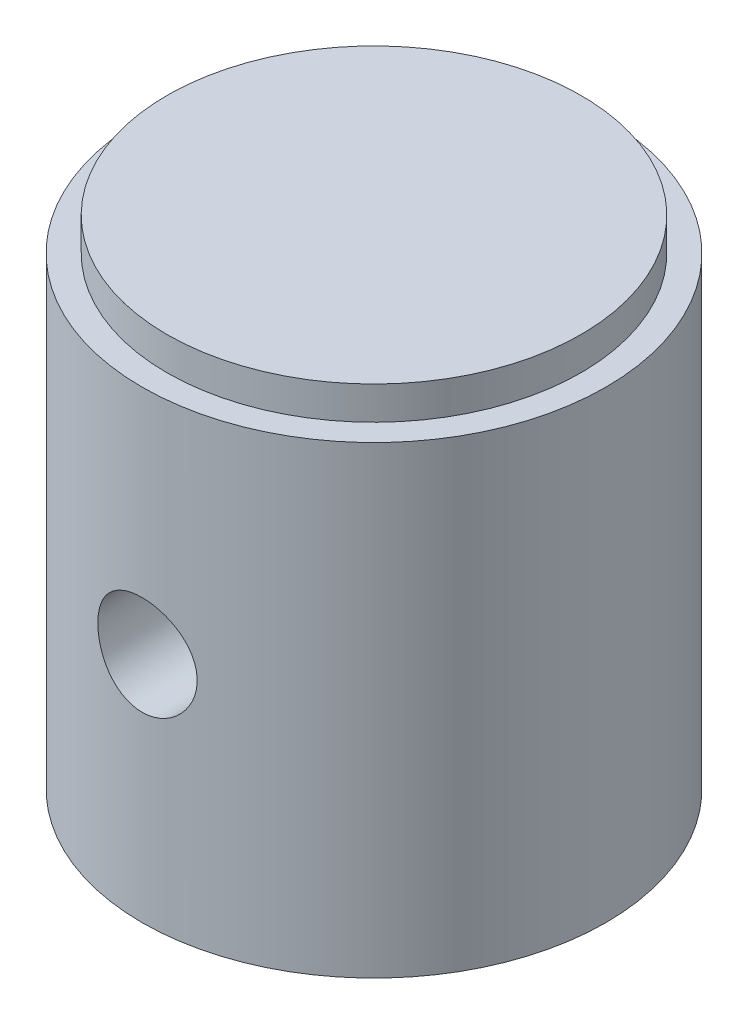
from build123d import *

# Parameters (mm, degrees)
CUT_EXTRUDE1_DEPTH      = 18.027499895
CUT_EXTRUDE1_DEPTH_BACK = 18.027499895
SKETCH2_R               = 1.5


with BuildPart() as part:
    # Sketch1 → Revolve1 (revolve)
    with BuildSketch(Plane.XY, mode=Mode.PRIVATE) as revolve1_sk:
        Polygon((0, 1.14591206), (-6.25, 1.14591206), (-6.25, 0.14591206), (-7, 0.14591206), (-7, -13.85408794), (-6.25, -13.85408794), (-4.75, -9.732871811), (-4.75, -2.85408794), (0, 0), align=None)
    revolve(revolve1_sk.sketch.rotate(Axis((0, 0, 0), (0, -1, 0)), 270), axis=Axis((0, 0, 0), (0, -1, 0)))

    # Sketch2 → Cut-Extrude1 (cut, two sides: drawn at the far end of the back side and taken through both)
    with BuildSketch(Plane.XY.offset(-CUT_EXTRUDE1_DEPTH_BACK)):
        with Locations((0, -6.85408794)):
            Circle(SKETCH2_R)
    extrude(amount=CUT_EXTRUDE1_DEPTH + CUT_EXTRUDE1_DEPTH_BACK, mode=Mode.SUBTRACT)


solid = part.part
